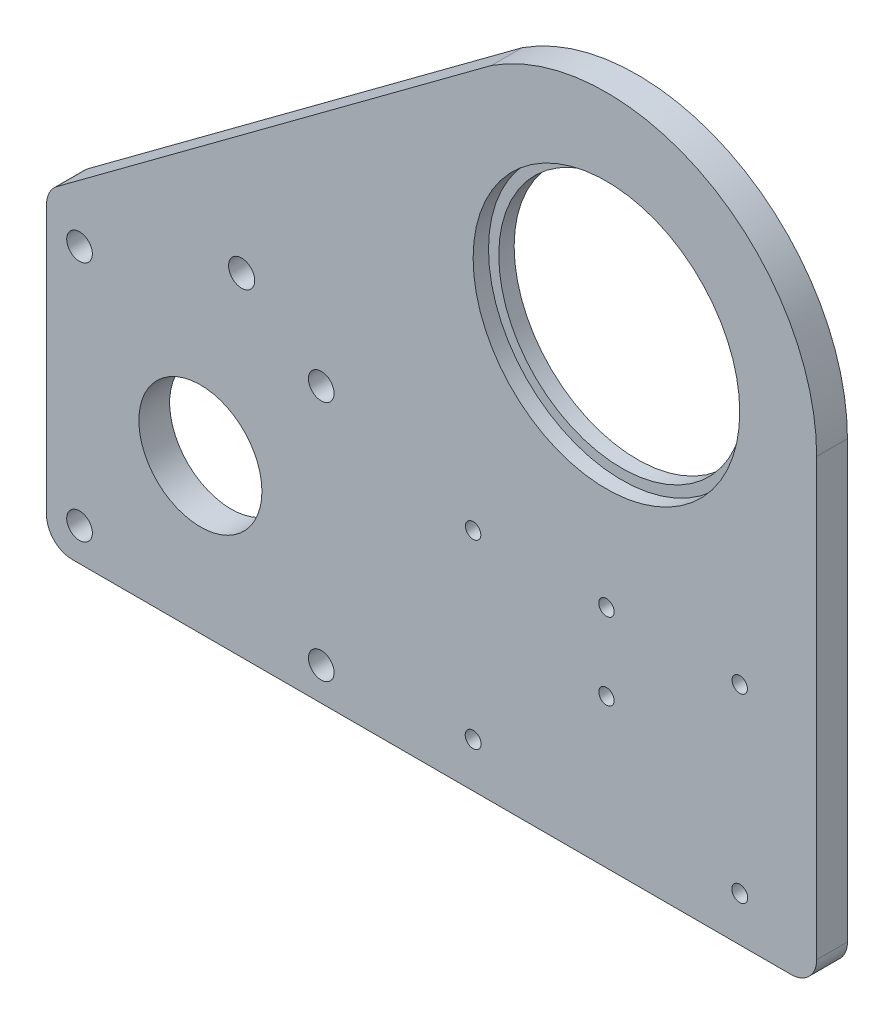
from build123d import *

# Parameters (mm, degrees)
SKETCH1_W           = 60
SKETCH1_H           = 60
SKETCH1_R           = 4
SKETCH1_R_2         = 26
BOSS_EXTRUDE1_DEPTH = 10
FILLET1_R           = 5
SKETCH3_R           = 26
SKETCH3_R_2         = 24
BOSS_EXTRUDE2_DEPTH = 3
SKETCH4_R           = 20
CUT_EXTRUDE1_DEPTH  = 1.6
SKETCH5_R           = 8
CUT_EXTRUDE2_DEPTH  = 158.213840184
SKETCH6_R           = 2.5
CUT_EXTRUDE3_DEPTH  = 158.307442752
SKETCH8_R           = 12
CUT_EXTRUDE5_DEPTH  = 158.213840184
SKETCH9_R           = 12
CUT_EXTRUDE6_DEPTH  = 4
SKETCH10_R          = 1.5
CUT_EXTRUDE7_DEPTH  = 158.103887747
SKETCH11_R          = 1.55
CUT_EXTRUDE8_DEPTH  = 158.103887747
SKETCH12_R          = 1.5
BOSS_EXTRUDE3_DEPTH = 6
SKETCH13_R          = 2.55
CUT_EXTRUDE9_DEPTH  = 158.103887747


with BuildPart() as part:
    # Sketch1 → Boss-Extrude1 (new body)
    # profile 1 of 3: a face of its own
    with BuildSketch(Plane.XY):
        with BuildLine():
            Line((52.853069415, 91.422204295), (-30, 30))
            Line((-30, 30), (30, 30))
            Line((30, 30), (30, -30))
            Line((30, -30), (120.187635495, -30))
            Line((120.187635495, -30), (120.187635495, 59.997840668))
            ThreePointArc((120.187635495, 59.997840668), (61.848621816, 22.844663083), (52.853069415, 91.422204295))
        make_face()
    # profile 2 of 3: a face of its own
    with BuildSketch(Plane.XY):
        Rectangle(SKETCH1_W, SKETCH1_H)
        Circle(SKETCH1_R, mode=Mode.SUBTRACT)
    # profile 3 of 3: a face of its own
    with BuildSketch(Plane.XY):
        with BuildLine():
            Line((56.774720343, 94.329476725), (52.853069415, 91.422204295))
            ThreePointArc((52.853069415, 91.422204295), (61.848621816, 22.844663083), (120.187635495, 59.997840668))
            ThreePointArc((120.187635495, 59.997840668), (98.707759454, 96.052864736), (56.774720343, 94.329476725))
        make_face()
        with Locations((79.187635495, 59.997840668)):
            Circle(SKETCH1_R_2, mode=Mode.SUBTRACT)
    extrude(amount=BOSS_EXTRUDE1_DEPTH)

    # Fillet1
    fillet1_edges = [part.edges().sort_by_distance(p)[0] for p in [
        (120.187635495, -30, 5),
        (-30, -30, 5),
        (-30, 30, 5),
    ]]
    fillet(fillet1_edges, radius=FILLET1_R)

    # Sketch3 → Boss-Extrude2 (add)
    with BuildSketch(Plane(origin=(0, 0, 0), x_dir=(-1, 0, 0), z_dir=(0, 0, -1))):
        with Locations((-79.187635495, 59.997840668)):
            Circle(SKETCH3_R)
        with Locations((-79.187635495, 59.997840668)):
            Circle(SKETCH3_R_2, mode=Mode.SUBTRACT)
    extrude(amount=-BOSS_EXTRUDE2_DEPTH)

    # Sketch4 → Cut-Extrude1 (cut)
    with BuildSketch(Plane.XY.offset(10)):
        Circle(SKETCH4_R)
    extrude(amount=-CUT_EXTRUDE1_DEPTH, mode=Mode.SUBTRACT)

    # Sketch5 → Cut-Extrude2 (cut, through all)
    with BuildSketch(Plane.XY.offset(8.4)):
        Circle(SKETCH5_R)
    extrude(amount=-CUT_EXTRUDE2_DEPTH, mode=Mode.SUBTRACT)

    # Sketch6 → Cut-Extrude3 (cut, through all)
    with BuildSketch(Plane.XY.offset(10)):
        with Locations((23.57, 23.57)):
            Circle(SKETCH6_R)
        with Locations((-23.57, 23.57)):
            Circle(SKETCH6_R)
        with Locations((-23.57, -23.57)):
            Circle(SKETCH6_R)
        with Locations((23.57, -23.57)):
            Circle(SKETCH6_R)
    extrude(amount=-CUT_EXTRUDE3_DEPTH, mode=Mode.SUBTRACT)

    # Sketch8 → Cut-Extrude5 (cut, through all)
    with BuildSketch(Plane.XY.offset(8.4)):
        Circle(SKETCH8_R)
    extrude(amount=-CUT_EXTRUDE5_DEPTH, mode=Mode.SUBTRACT)

    # Sketch9 → Cut-Extrude6 (cut)
    with BuildSketch(Plane.XY.offset(10)):
        with BuildLine():
            Line((-25, -30), (115.187635495, -30))
            ThreePointArc((115.187635495, -30), (118.723169401, -28.535533906), (120.187635495, -25))
            Line((120.187635495, -25), (120.187635495, 59.997840668))
            ThreePointArc((120.187635495, 59.997840668), (98.707759454, 96.052864736), (56.774720343, 94.329476725))
            Line((56.774720343, 94.329476725), (-27.977688922, 31.499217893))
            ThreePointArc((-27.977688922, 31.499217893), (-29.465895465, 29.731087062), (-30, 27.482581404))
            Line((-30, 27.482581404), (-30, -25))
            ThreePointArc((-30, -25), (-28.535533906, -28.535533906), (-25, -30))
        make_face()
        Circle(SKETCH9_R, mode=Mode.SUBTRACT)
    extrude(amount=-CUT_EXTRUDE6_DEPTH, mode=Mode.SUBTRACT)

    # Sketch10 → Cut-Extrude7 (cut, through all)
    with BuildSketch(Plane.XY.offset(6)):
        with Locations((53.187635495, -16.002159332)):
            Circle(SKETCH10_R)
        with Locations((105.187635495, -16.002159332)):
            Circle(SKETCH10_R)
        with Locations((105.187635495, 13.997840668)):
            Circle(SKETCH10_R)
        with Locations((79.187635495, -1.002159332)):
            Circle(SKETCH10_R)
        with Locations((53.187635495, 13.997840668)):
            Circle(SKETCH10_R)
        with Locations((79.187635495, 13.997840668)):
            Circle(SKETCH10_R)
    extrude(amount=-CUT_EXTRUDE7_DEPTH, mode=Mode.SUBTRACT)

    # Sketch11 → Cut-Extrude8 (cut, through all)
    with BuildSketch(Plane.XY.offset(6)):
        with Locations((53.187635495, -21.3)):
            Circle(SKETCH11_R)
        with Locations((105.187635495, -21.3)):
            Circle(SKETCH11_R)
    extrude(amount=-CUT_EXTRUDE8_DEPTH, mode=Mode.SUBTRACT)

    # Sketch12 → Boss-Extrude3 (add)
    with BuildSketch(Plane.XY.offset(6)):
        with Locations((53.187635495, -16.002159332)):
            Circle(SKETCH12_R)
        with Locations((105.187635495, -16.002159332)):
            Circle(SKETCH12_R)
    extrude(amount=-BOSS_EXTRUDE3_DEPTH)

    # Sketch13 → Cut-Extrude9 (cut, through all)
    with BuildSketch(Plane(origin=(0, 0, 0), x_dir=(-1, 0, 0), z_dir=(0, 0, -1))):
        with Locations((-8.043910978, 34.887394427)):
            Circle(SKETCH13_R)
    extrude(amount=-CUT_EXTRUDE9_DEPTH, mode=Mode.SUBTRACT)


solid = part.part
